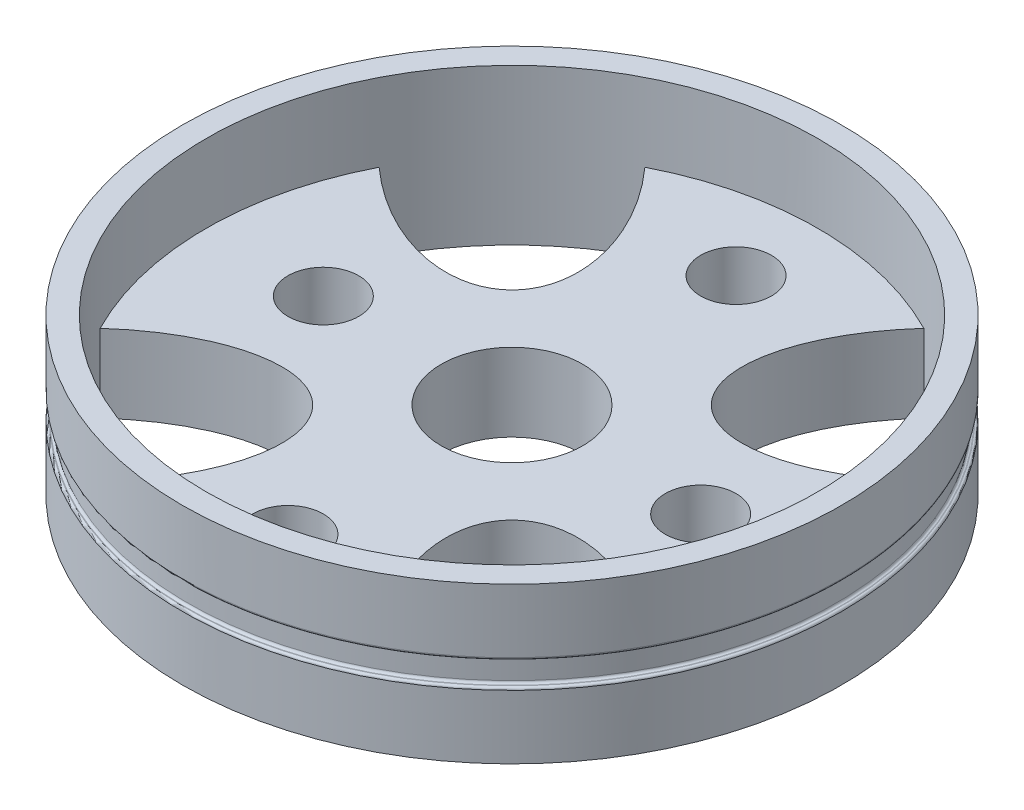
from build123d import *

# Parameters (mm, degrees)
SKETCH1_R               = 13.975
BOSS_EXTRUDE1_DEPTH     = 6.6
SKETCH2_R               = 12.975
CUT_EXTRUDE1_DEPTH      = 3.3
CUT_EXTRUDE2_DEPTH      = 0.5
CUT_EXTRUDE2_DEPTH_BACK = 0.5
SKETCH4_R               = 13.975
SKETCH4_R_2             = 13.75
FILLET1_R               = 0.1
SKETCH5_R               = 3
SKETCH5_R_2             = 1.5
CUT_EXTRUDE4_DEPTH      = 3.3


with BuildPart() as part:
    # Sketch1 → Boss-Extrude1 (new body)
    with BuildSketch(Plane(origin=(0, 0, 0), x_dir=(1, 0, 0), z_dir=(0, 1, 0))):
        with Locations(Location((0, 0, 0), (0, 0, 270))):
            Circle(SKETCH1_R)
    extrude(amount=BOSS_EXTRUDE1_DEPTH)

    # Sketch2 → Cut-Extrude1 (cut)
    with BuildSketch(Plane(origin=(0, 6.6, 0), x_dir=(1, 0, 0), z_dir=(0, 1, 0))):
        with Locations(Location((0, 0, 0), (0, 0, 270))):
            Circle(SKETCH2_R)
    extrude(amount=-CUT_EXTRUDE1_DEPTH, mode=Mode.SUBTRACT)

    # Sketch4 → Cut-Extrude2 (cut, two sides: drawn at the far end of the back side and taken through both)
    with BuildSketch(Plane(origin=(0, 3.3, 13.975), x_dir=(1, 0, 0), z_dir=(0, 1, 0)).offset(-CUT_EXTRUDE2_DEPTH_BACK)):
        with Locations(Location((0, 13.975, 0), (0, 0, 180))):
            Circle(SKETCH4_R)
        with Locations(Location((0, 13.975, 0), (0, 0, 180))):
            Circle(SKETCH4_R_2, mode=Mode.SUBTRACT)
    extrude(amount=CUT_EXTRUDE2_DEPTH + CUT_EXTRUDE2_DEPTH_BACK, mode=Mode.SUBTRACT)

    # Fillet1
    fillet1_edges = [part.edges().sort_by_distance(p)[0] for p in [
        (0, 3.8, -13.975),
        (0, 2.8, -13.975),
        (13.75, 3.8, 0),
        (13.75, 2.8, 0),
    ]]
    fillet(fillet1_edges, radius=FILLET1_R)

    # Sketch5 → Cut-Extrude4 (cut)
    with BuildSketch(Plane(origin=(0, 3.3, 0), x_dir=(1, 0, 0), z_dir=(0, 1, 0))):
        with Locations(Location((0, 0, 0), (0, 0, 270))):
            Circle(SKETCH5_R)
        with Locations(Location((8, 0, 0), (0, 0, 270))):
            Circle(SKETCH5_R_2)
        with Locations(Location((0, 9.5, 0), (0, 0, 270))):
            Circle(SKETCH5_R_2)
        with Locations(Location((0, -9.5, 0), (0, 0, 270))):
            Circle(SKETCH5_R_2)
        with Locations(Location((-8, 0, 0), (0, 0, 270))):
            Circle(SKETCH5_R_2)
        with BuildLine():
            ThreePointArc((11.548586923, -5.914453913), (9.174710486, -9.174710486), (5.914453913, -11.548586923))
            add(Edge.make_bspline(
                [(11.548586923, -5.914453913), (6.810523801, -1.639402234), (4.224963018, -4.224963018), (1.639402234, -6.810523801), (5.914453913, -11.548586923)],
                knots=[1.660454314, 1.660454314, 1.660454314, 3.141592654, 3.141592654, 4.622730994, 4.622730994, 4.622730994], degree=2, weights=[1, 0.738084655, 1, 0.738084655, 1]))
        make_face()
        with BuildLine():
            ThreePointArc((-5.914453913, -11.548586923), (-9.174710486, -9.174710486), (-11.548586923, -5.914453913))
            add(Edge.make_bspline(
                [(-5.914453913, -11.548586923), (-1.639402234, -6.810523801), (-4.224963018, -4.224963018), (-6.810523801, -1.639402234), (-11.548586923, -5.914453913)],
                knots=[1.660454314, 1.660454314, 1.660454314, 3.141592654, 3.141592654, 4.622730994, 4.622730994, 4.622730994], degree=2, weights=[1, 0.738084655, 1, 0.738084655, 1]))
        make_face()
        with BuildLine():
            ThreePointArc((-11.548586923, 5.914453913), (-9.174710486, 9.174710486), (-5.914453913, 11.548586923))
            add(Edge.make_bspline(
                [(-11.548586923, 5.914453913), (-6.810523801, 1.639402234), (-4.224963018, 4.224963018), (-1.639402234, 6.810523801), (-5.914453913, 11.548586923)],
                knots=[1.660454314, 1.660454314, 1.660454314, 3.141592654, 3.141592654, 4.622730994, 4.622730994, 4.622730994], degree=2, weights=[1, 0.738084655, 1, 0.738084655, 1]))
        make_face()
        with BuildLine():
            ThreePointArc((5.914453913, 11.548586923), (9.174710486, 9.174710486), (11.548586923, 5.914453913))
            add(Edge.make_bspline(
                [(5.914453913, 11.548586923), (1.639402234, 6.810523801), (4.224963018, 4.224963018), (6.810523801, 1.639402234), (11.548586923, 5.914453913)],
                knots=[4.802046967, 4.802046967, 4.802046967, 6.283185307, 6.283185307, 7.764323647, 7.764323647, 7.764323647], degree=2, weights=[1, 0.738084655, 1, 0.738084655, 1]))
        make_face()
    extrude(amount=-CUT_EXTRUDE4_DEPTH, mode=Mode.SUBTRACT)


solid = part.part
